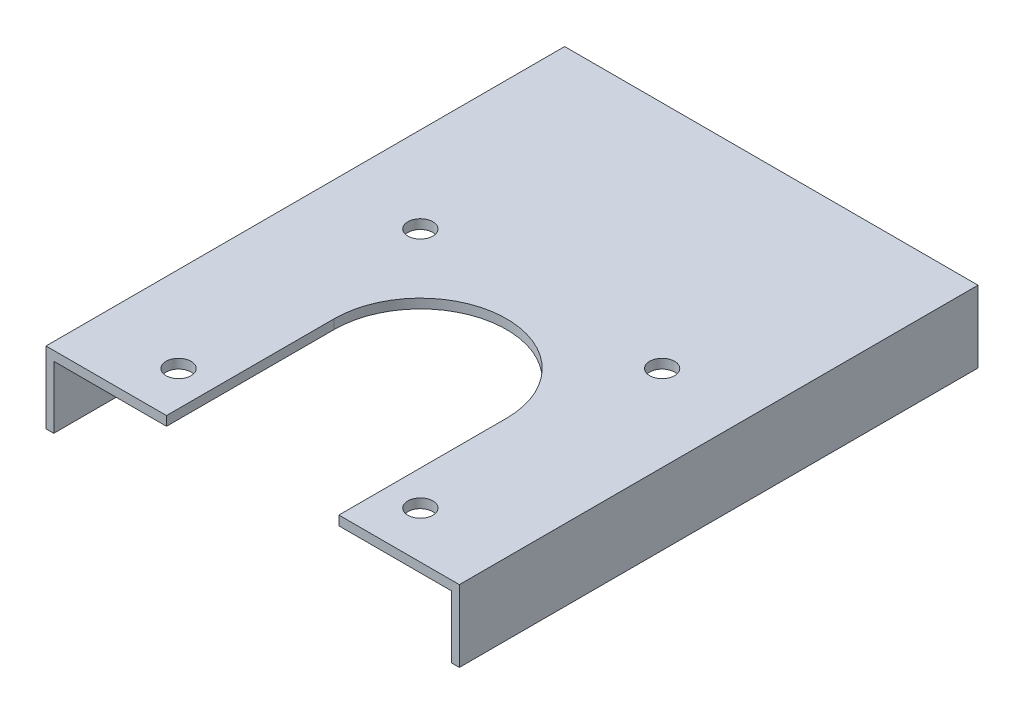
from build123d import *

# Parameters (mm, degrees)
SKETCH_1_R          = 1.6
EXTRUDE_1_DEPTH     = 1.2
EXTRUDE_2_DEPTH     = 8
SKETCH_3_R          = 1.6
CUT_EXTRUDE_1_DEPTH = 8


with BuildPart() as part:
    # 草图1 → 凸台-拉伸1 (new body)
    with BuildSketch(Plane(origin=(0, 0, 0), x_dir=(1, 0, 0), z_dir=(0, 1, 0))):
        with BuildLine():
            Line((15.45, 0), (15.45, 21.5))
            ThreePointArc((15.45, 21.5), (26.5, 32.55), (37.55, 21.5))
            Line((37.55, 21.5), (37.55, 0))
            Line((37.55, 0), (53, 0))
            Line((53, 0), (53, 66.5))
            Line((53, 66.5), (0, 66.5))
            Line((0, 66.5), (0, 0))
            Line((0, 0), (15.45, 0))
        make_face()
        with Locations(Location((11, 6, 0), (0, 0, 270))):
            Circle(SKETCH_1_R, mode=Mode.SUBTRACT)
        with Locations(Location((11, 37, 0), (0, 0, 270))):
            Circle(SKETCH_1_R, mode=Mode.SUBTRACT)
        with Locations(Location((42, 37, 0), (0, 0, 90))):
            Circle(SKETCH_1_R, mode=Mode.SUBTRACT)
        with Locations(Location((42, 6, 0), (0, 0, 90))):
            Circle(SKETCH_1_R, mode=Mode.SUBTRACT)
    extrude(amount=EXTRUDE_1_DEPTH)

    # 草图2 → 凸台-拉伸2 (add)
    with BuildSketch(Plane.XZ):
        Polygon((1, 0), (1, -65.5), (52, -65.5), (52, 0), (53, 0), (53, -66.5), (0, -66.5), (0, 0), align=None)
    extrude(amount=EXTRUDE_2_DEPTH)

    # 草图3 → 切除-拉伸1 (cut)
    with BuildSketch(Plane(origin=(0, 0, -66.5), x_dir=(-1, 0, 0), z_dir=(0, 0, -1))):
        with Locations((-11.5, -4)):
            Circle(SKETCH_3_R)
        with Locations((-41.5, -4)):
            Circle(SKETCH_3_R)
    extrude(amount=-CUT_EXTRUDE_1_DEPTH, mode=Mode.SUBTRACT)


solid = part.part
